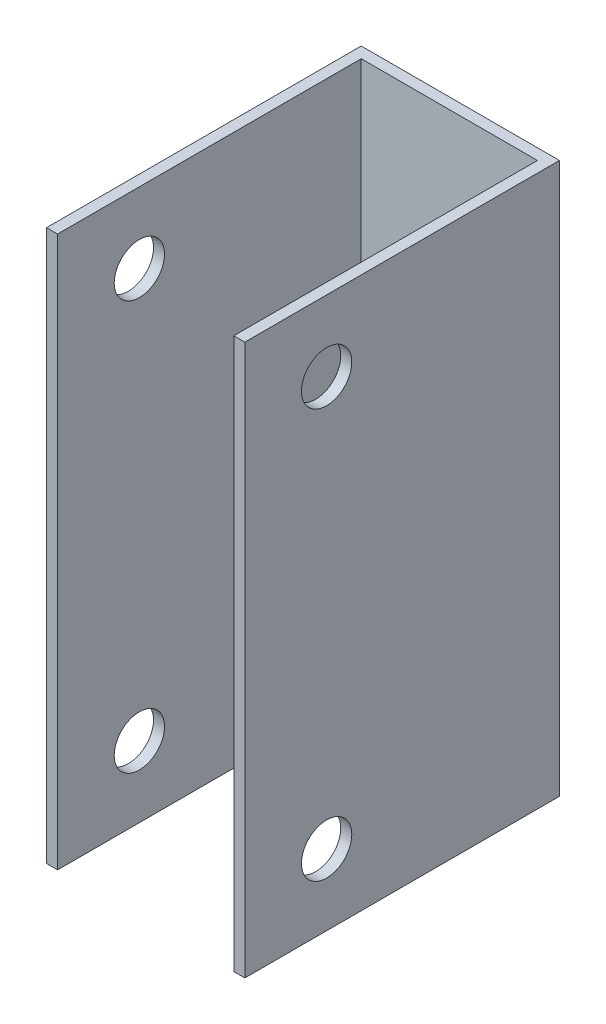
from build123d import *

# Parameters (mm, degrees)
EXTRUDE_1_DEPTH     = 35
SKETCH_2_R          = 1.6
CUT_EXTRUDE_1_DEPTH = 43.234582986


with BuildPart() as part:
    # 草图1 → 凸台-拉伸1 (new body)
    with BuildSketch(Plane(origin=(0, 0, 0), x_dir=(1, 0, 0), z_dir=(0, 1, 0))):
        Polygon((0, 0), (0, 20), (12.6, 20), (12.6, 9.502030119), (12.6, 0), (11.9, 0), (11.9, 19.3), (0.7, 19.3), (0.7, 0), align=None)
    extrude(amount=EXTRUDE_1_DEPTH)

    # 草图2 → 切除-拉伸1 (cut, through all)
    with BuildSketch(Plane.ZY):
        with Locations((-5.2, 30.5)):
            Circle(SKETCH_2_R)
        with Locations((-5.2, 4.5)):
            Circle(SKETCH_2_R)
    extrude(amount=-CUT_EXTRUDE_1_DEPTH, mode=Mode.SUBTRACT)


solid = part.part
